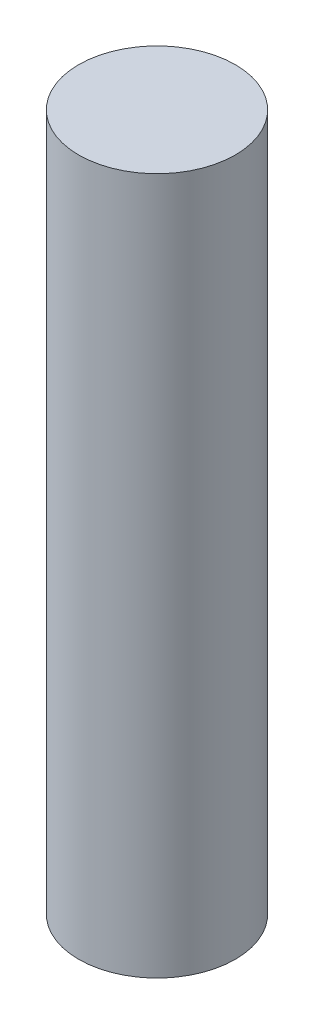
from build123d import *

# Parameters (mm, degrees)
SKETCH1_R           = 12.7
BOSS_EXTRUDE1_DEPTH = 113


with BuildPart() as part:
    # Sketch1 → Boss-Extrude1 (new body)
    with BuildSketch(Plane(origin=(0, 0, 0), x_dir=(1, 0, 0), z_dir=(0, 1, 0))):
        with Locations(Location((0, 0, 0), (0, 0, 270))):
            Circle(SKETCH1_R)
    extrude(amount=BOSS_EXTRUDE1_DEPTH)


solid = part.part
